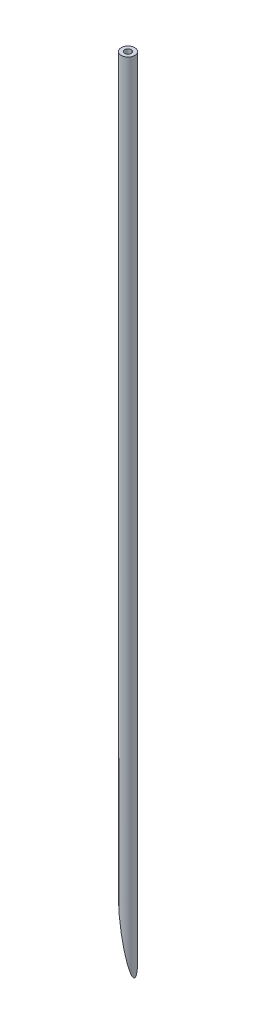
from build123d import *

# Parameters (mm, degrees)
SKETCH_2_R               = 0.255
SKETCH_2_R_2             = 0.125
EXTRUDE_1_DEPTH          = 30
CUT_EXTRUDE_1_DEPTH      = 11
CUT_EXTRUDE_1_DEPTH_BACK = 10


with BuildPart() as part:
    # 草图2 → 凸台-拉伸1 (new body)
    with BuildSketch(Plane(origin=(0, 0, 0), x_dir=(1, 0, 0), z_dir=(0, 1, 0))):
        with Locations(Location((0, 0, 0), (0, 0, 270))):
            Circle(SKETCH_2_R)
        with Locations(Location((0, 0, 0), (0, 0, 270))):
            Circle(SKETCH_2_R_2, mode=Mode.SUBTRACT)
    extrude(amount=-EXTRUDE_1_DEPTH)

    # 草图3 → 切除-拉伸1 (cut, two sides: drawn at the far end of the back side and taken through both)
    with BuildSketch(Plane.XY.offset(-CUT_EXTRUDE_1_DEPTH_BACK)):
        Polygon((8.020684353, -74.041384488), (0.255, -30), (-0.296000993, -26.875118088), (-0.296000993, -80.940381898), (0.255, -80.940381898), (8.020684353, -80.940381898), align=None)
    extrude(amount=CUT_EXTRUDE_1_DEPTH + CUT_EXTRUDE_1_DEPTH_BACK, mode=Mode.SUBTRACT)


solid = part.part
